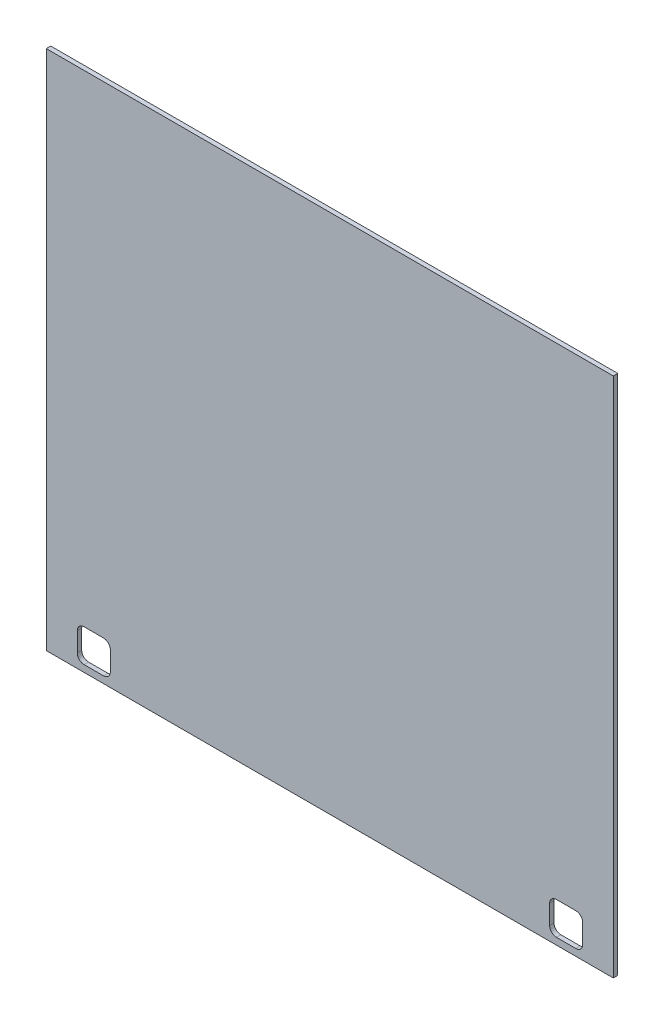
from build123d import *

# Parameters (mm, degrees)
ESQUISSE1_W                = 832
ESQUISSE1_H                = 765
BOSS_EXTRU_1_DEPTH         = 6.5
ENL_V_MAT_EXTRU_1_DEPTH    = 566.158827234
R_P_TITION_LIN_AIRE1_COUNT = 2
R_P_TITION_LIN_AIRE1_PITCH = 693


with BuildPart() as part:
    # Esquisse1 → Boss.-Extru.1 (new body)
    with BuildSketch(Plane.XY):
        Rectangle(ESQUISSE1_W, ESQUISSE1_H)
    extrude(amount=BOSS_EXTRU_1_DEPTH)

    # Esquisse2 → Enlèv. mat.-Extru.1 (cut, through all)
    with BuildSketch(Plane(origin=(0, 0, 0), x_dir=(-1, 0, 0), z_dir=(0, 0, -1))):
        with BuildLine():
            Line((-361, -372.521350197), (-332.52602316, -372.521350197))
            ThreePointArc((-332.52602316, -372.521350197), (-325.454955349, -369.592418009), (-322.52602316, -362.521350197))
            Line((-322.52602316, -362.521350197), (-322.52602316, -334.475228476))
            ThreePointArc((-322.52602316, -334.475228476), (-325.454955349, -327.404160664), (-332.52602316, -324.475228476))
            Line((-332.52602316, -324.475228476), (-361, -324.475228476))
            ThreePointArc((-361, -324.475228476), (-368.071067812, -327.404160664), (-371, -334.475228476))
            Line((-371, -334.475228476), (-371, -362.521350197))
            ThreePointArc((-371, -362.521350197), (-368.071067812, -369.592418009), (-361, -372.521350197))
        make_face()
    enl_v_mat_extru_1 = extrude(amount=-ENL_V_MAT_EXTRU_1_DEPTH, mode=Mode.SUBTRACT)

    # Répétition linéaire1: Enlèv. mat.-Extru.1 ×2
    with Locations(*[(-i * R_P_TITION_LIN_AIRE1_PITCH, 0, 0) for i in range(1, R_P_TITION_LIN_AIRE1_COUNT)]):
        add(enl_v_mat_extru_1, mode=Mode.SUBTRACT)


solid = part.part
